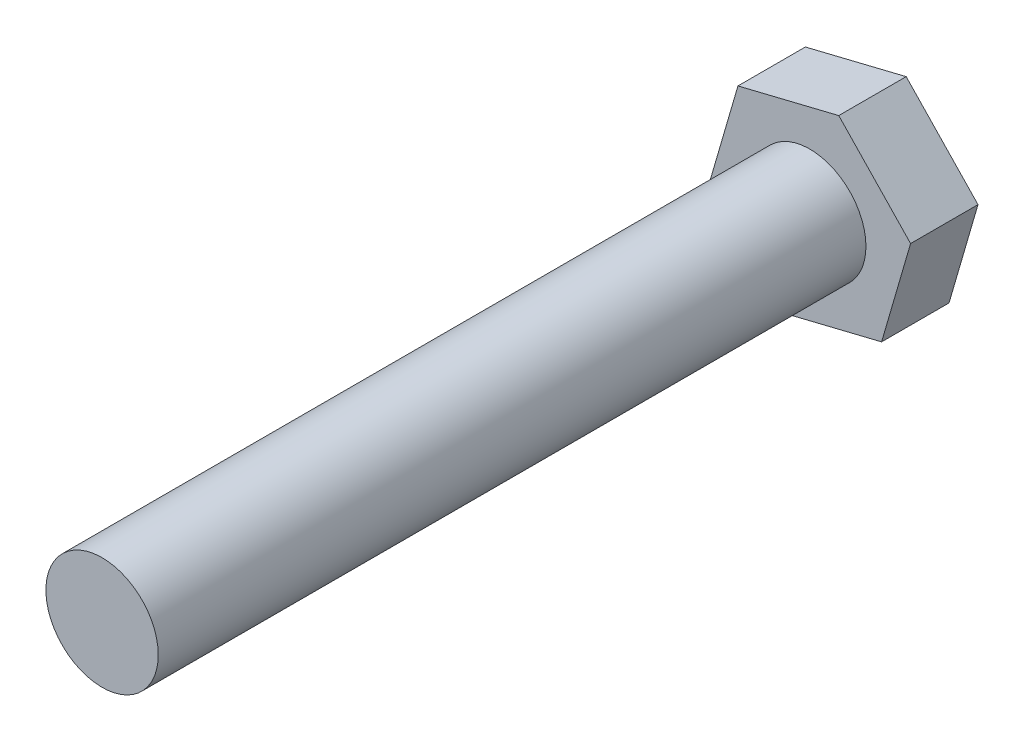
from build123d import *

# Parameters (mm, degrees)
BOSS_EXTRUDE1_DEPTH = 3
SKETCH2_R           = 2.5
BOSS_EXTRUDE2_DEPTH = 31.492


with BuildPart() as part:
    # Sketch1 → Boss-Extrude1 (new body)
    with BuildSketch(Plane.XY):
        Polygon((-3.195773982, 3.334720677), (-4.485839811, -1.100261115), (-1.29006583, -4.434981791), (3.195773982, -3.334720677), (4.485839811, 1.100261115), (1.29006583, 4.434981791), align=None)
    extrude(amount=BOSS_EXTRUDE1_DEPTH)

    # Sketch2 → Boss-Extrude2 (add)
    with BuildSketch(Plane.XY.offset(3)):
        Circle(SKETCH2_R)
    extrude(amount=BOSS_EXTRUDE2_DEPTH)


solid = part.part
